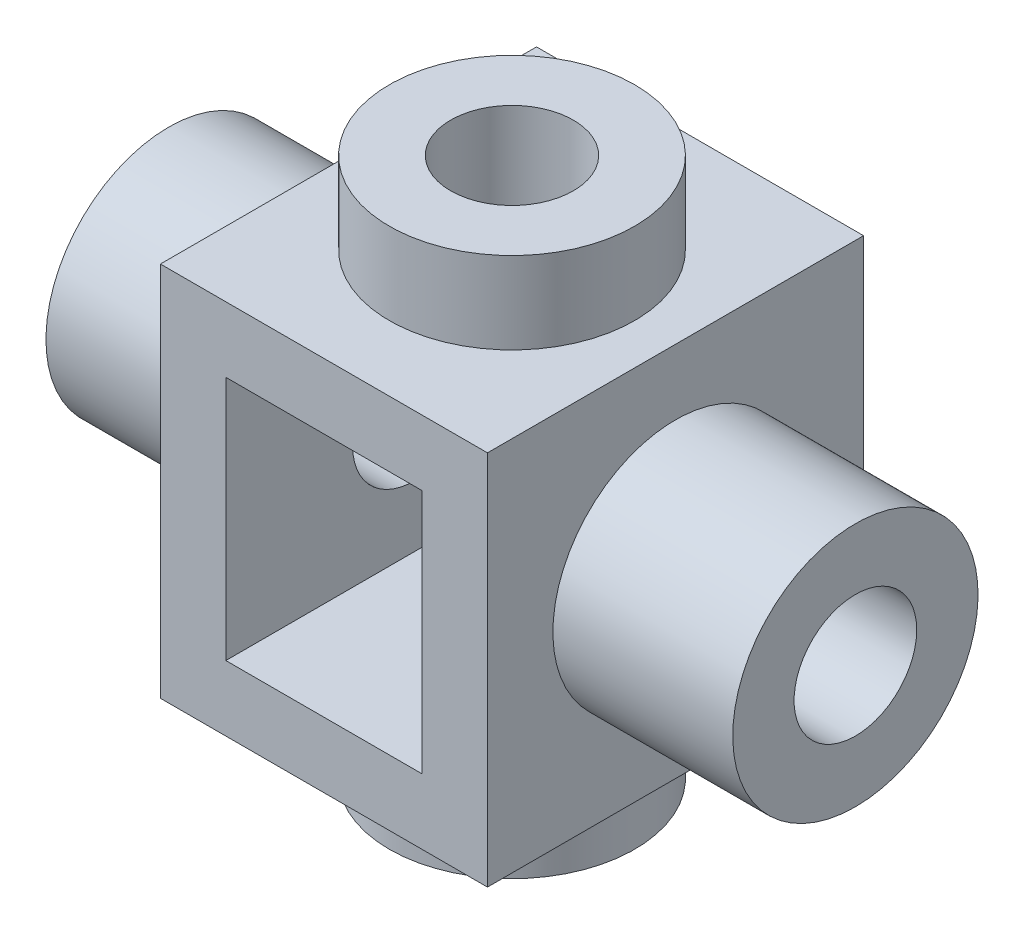
from build123d import *

# Parameters (mm, degrees)
SKETCH1_W                      = 46
SKETCH1_H                      = 46
BOSS_EXTRUDE1_DEPTH            = 40
SKETCH2_W                      = 24
SKETCH2_H                      = 30
CUT_EXTRUDE1_DEPTH             = 56.181518645
SKETCH3_W                      = 15
SKETCH3_H                      = 10
SKETCH4_W                      = 15
SKETCH4_H                      = 10
SKETCH5_W                      = 22
SKETCH5_H                      = 15
SKETCH6_W                      = 22
SKETCH6_H                      = 15
F_15_0_15_DIAMETER_HOLE1_D     = 15
F_15_0_15_DIAMETER_HOLE1_DEPTH = 18
F_15_0_15_DIAMETER_HOLE2_D     = 15
F_15_0_15_DIAMETER_HOLE2_DEPTH = 66
F_15_0_15_DIAMETER_HOLE3_D     = 15
F_15_0_15_DIAMETER_HOLE3_DEPTH = 30
F_15_0_15_DIAMETER_HOLE4_D     = 15
F_15_0_15_DIAMETER_HOLE4_DEPTH = 84


with BuildPart() as part:
    # Sketch1 → Boss-Extrude1 (new body)
    with BuildSketch(Plane(origin=(-20, 0, 0), x_dir=(0, -1, 0), z_dir=(-1, 0, 0))):
        with Locations((0, -23)):
            Rectangle(SKETCH1_W, SKETCH1_H)
    extrude(amount=-BOSS_EXTRUDE1_DEPTH)

    # Sketch2 → Cut-Extrude1 (cut, through all)
    with BuildSketch(Plane(origin=(0, 0, -46), x_dir=(-1, 0, 0), z_dir=(0, 0, -1))):
        Rectangle(SKETCH2_W, SKETCH2_H)
    extrude(amount=-CUT_EXTRUDE1_DEPTH, mode=Mode.SUBTRACT)

    # Sketch3 → Revolve1 (revolve)
    with BuildSketch(Plane(origin=(0, 0, -23), x_dir=(-1, 0, 0), z_dir=(0, 0, -1)), mode=Mode.PRIVATE) as revolve1_sk:
        with Locations((-7.5, -28)):
            Rectangle(SKETCH3_W, SKETCH3_H)
    revolve(revolve1_sk.sketch.rotate(Axis((0, -33, -23), (0, 1, 0)), 270), axis=Axis((0, -33, -23), (0, 1, 0)))

    # Sketch4 → Revolve2 (revolve)
    with BuildSketch(Plane.XY.offset(-23), mode=Mode.PRIVATE) as revolve2_sk:
        with Locations((7.5, 28)):
            Rectangle(SKETCH4_W, SKETCH4_H)
    revolve(revolve2_sk.sketch.rotate(Axis((0, 33, -23), (0, -1, 0)), 270), axis=Axis((0, 33, -23), (0, -1, 0)))

    # Sketch5 → Revolve3 (revolve)
    with BuildSketch(Plane.XY.offset(-23)):
        with Locations((-31, 7.5)):
            Rectangle(SKETCH5_W, SKETCH5_H)
    revolve(axis=Axis((-42, 0, -23), (1, 0, 0)))

    # Sketch6 → Revolve4 (revolve)
    with BuildSketch(Plane(origin=(0, 0, -23), x_dir=(-1, 0, 0), z_dir=(0, 0, -1)), mode=Mode.PRIVATE) as revolve4_sk:
        with Locations((-31, 7.5)):
            Rectangle(SKETCH6_W, SKETCH6_H)
    revolve(revolve4_sk.sketch.rotate(Axis((42, 0, -23), (-1, 0, 0)), 180), axis=Axis((42, 0, -23), (-1, 0, 0)))

    # Ø15.0 (15) Diameter Hole1
    with Locations(Plane(origin=(0, -33, 0), x_dir=(-1, 0, 0), z_dir=(0, -1, 0))):
        with Locations((0, 23)):
            Hole(F_15_0_15_DIAMETER_HOLE1_D / 2, depth=F_15_0_15_DIAMETER_HOLE1_DEPTH)

    # Ø15.0 (15) Diameter Hole2
    with Locations(Plane(origin=(0, 33, 0), x_dir=(1, 0, 0), z_dir=(0, 1, 0))):
        with Locations((0, 23)):
            Hole(F_15_0_15_DIAMETER_HOLE2_D / 2, depth=F_15_0_15_DIAMETER_HOLE2_DEPTH)

    # Ø15.0 (15) Diameter Hole3
    with Locations(Plane.ZY.offset(42)):
        with Locations((-23, 0)):
            Hole(F_15_0_15_DIAMETER_HOLE3_D / 2, depth=F_15_0_15_DIAMETER_HOLE3_DEPTH)

    # Ø15.0 (15) Diameter Hole4
    with Locations(Plane(origin=(42, 0, 0), x_dir=(0, 0, -1), z_dir=(1, 0, 0))):
        with Locations((23, 0)):
            Hole(F_15_0_15_DIAMETER_HOLE4_D / 2, depth=F_15_0_15_DIAMETER_HOLE4_DEPTH)


solid = part.part
